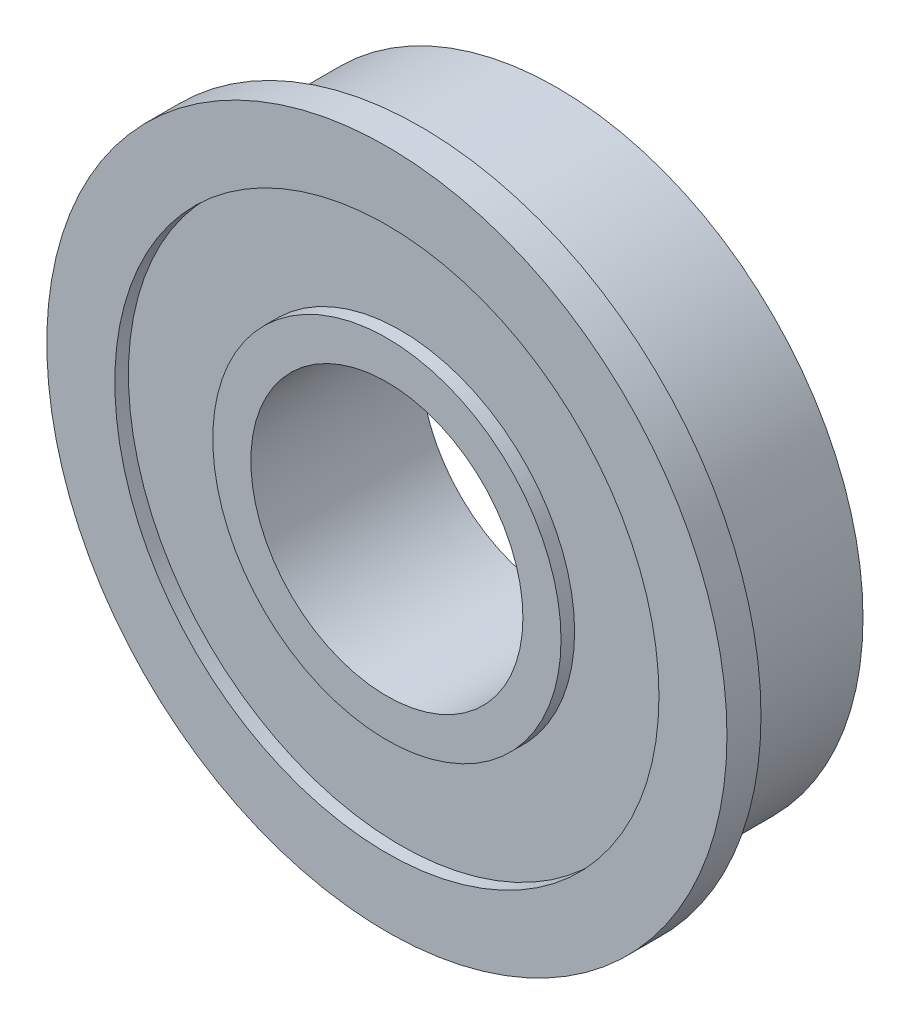
from build123d import *


with BuildPart() as part:
    # Sketch1 → Revolve1 (revolve)
    with BuildSketch(Plane(origin=(0, 0, 0), x_dir=(1, 0, 0), z_dir=(0, 1, 0))):
        Polygon((6.35, -3.96875), (8.128, -3.96875), (8.128, -3.33375), (12.7, -3.33375), (12.7, -3.96875), (15.875, -3.96875), (15.875, -2.38125), (14.2875, -2.38125), (14.2875, 3.96875), (12.7, 3.96875), (12.7, 3.33375), (8.128, 3.33375), (8.128, 3.96875), (6.35, 3.96875), align=None)
    revolve(axis=Axis((0, 0, -3.96875), (0, 0, 1)))


solid = part.part
